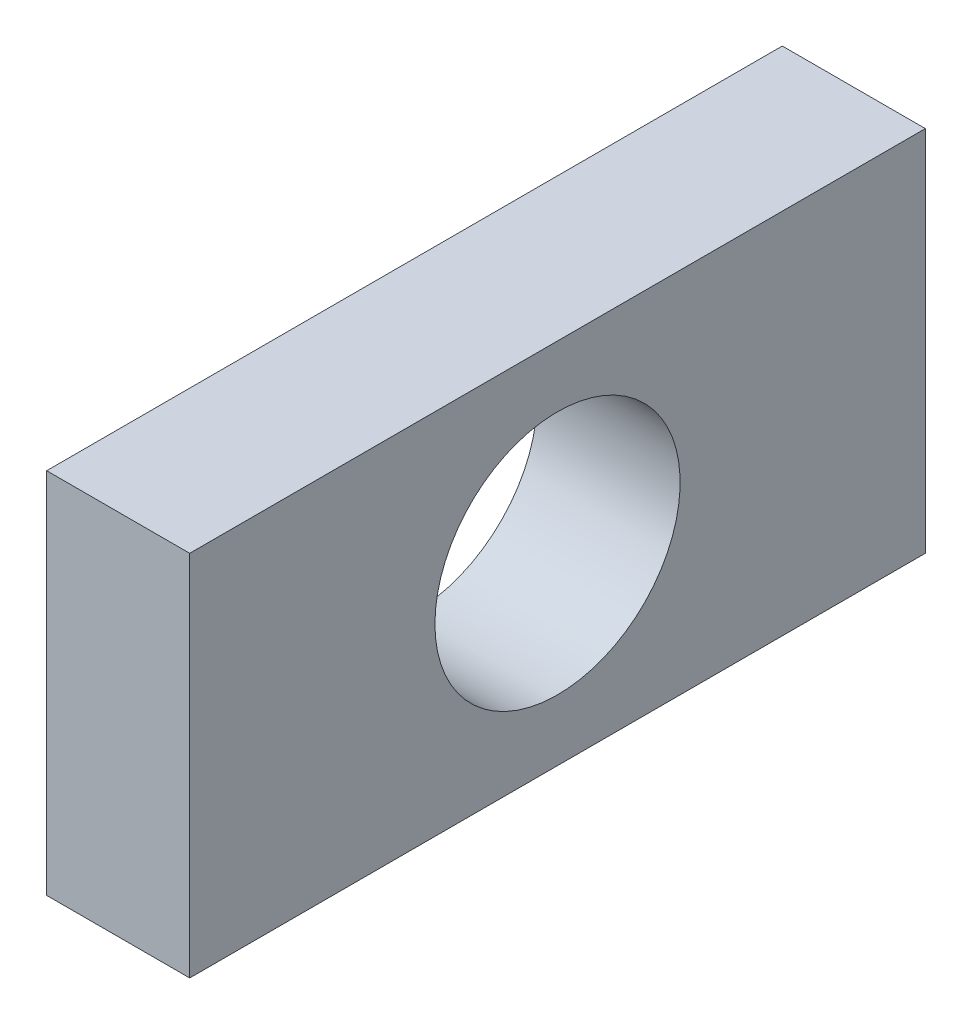
from build123d import *

# Parameters (mm, degrees)
SKETCH1_W           = 57.15
SKETCH1_H           = 28.575
BOSS_EXTRUDE1_DEPTH = 11.1125
SKETCH2_R           = 9.525
CUT_EXTRUDE1_DEPTH  = 65.854766835


with BuildPart() as part:
    # Sketch1 → Boss-Extrude1 (new body)
    with BuildSketch(Plane(origin=(0, 0, 0), x_dir=(0, 0, -1), z_dir=(1, 0, 0))):
        with Locations((28.575, 14.2875)):
            Rectangle(SKETCH1_W, SKETCH1_H)
    extrude(amount=BOSS_EXTRUDE1_DEPTH)

    # Sketch2 → Cut-Extrude1 (cut, through all)
    with BuildSketch(Plane.ZY):
        with Locations((-28.575, 14.2875)):
            Circle(SKETCH2_R)
    extrude(amount=-CUT_EXTRUDE1_DEPTH, mode=Mode.SUBTRACT)


solid = part.part
